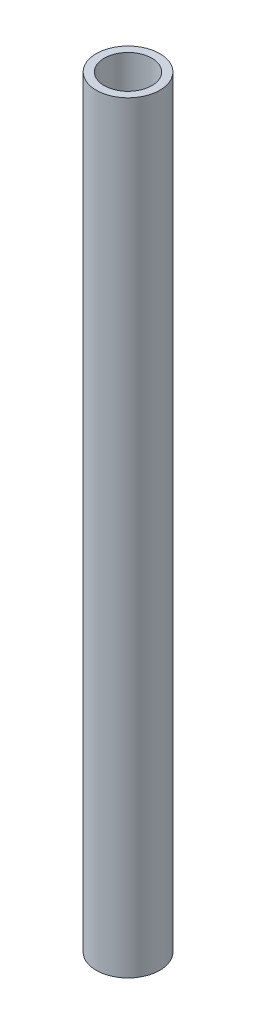
from build123d import *

# Parameters (mm, degrees)
SKETCH1_R           = 12.7
SKETCH1_R_2         = 9.525
BOSS_EXTRUDE1_DEPTH = 304.8


with BuildPart() as part:
    # Sketch1 → Boss-Extrude1 (new body)
    with BuildSketch(Plane(origin=(0, 0, 0), x_dir=(1, 0, 0), z_dir=(0, 1, 0))):
        with Locations(Location((0, 0, 0), (0, 0, 90))):
            Circle(SKETCH1_R)
        with Locations(Location((0, 0, 0), (0, 0, 90))):
            Circle(SKETCH1_R_2, mode=Mode.SUBTRACT)
    extrude(amount=BOSS_EXTRUDE1_DEPTH)


solid = part.part
